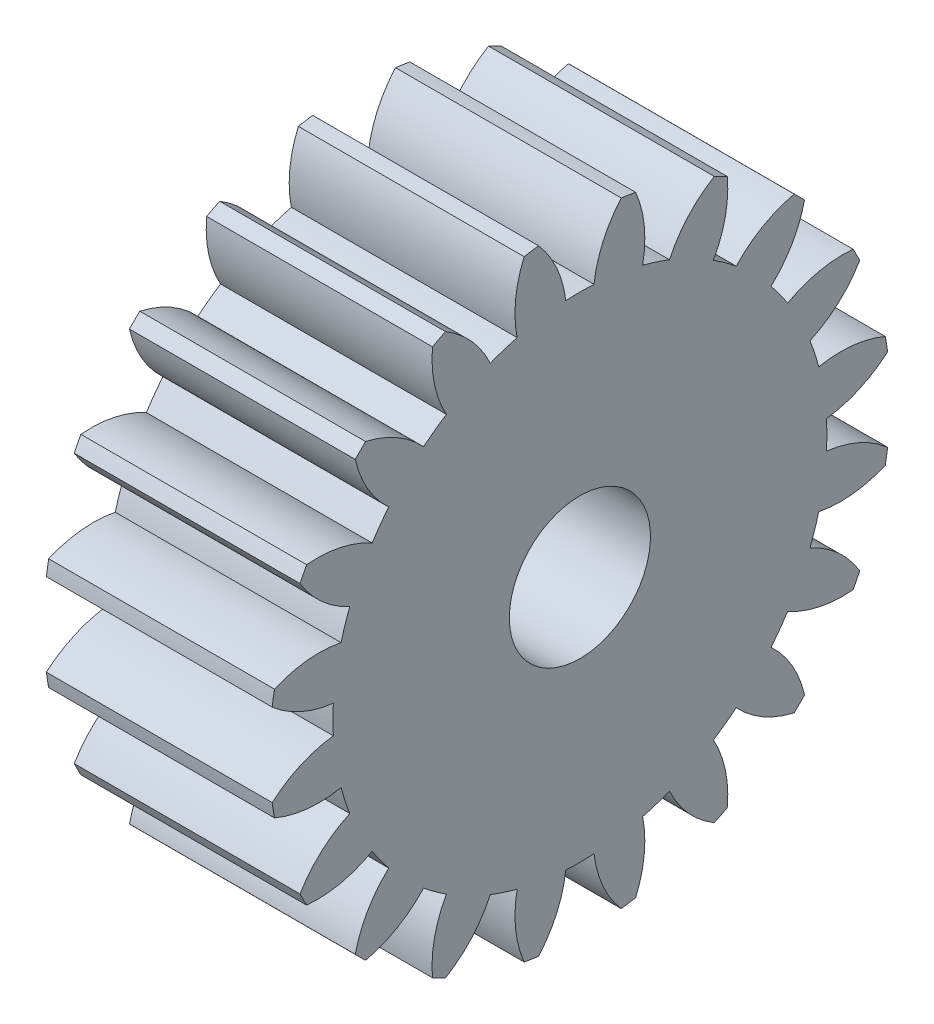
from build123d import *

# Parameters (mm, degrees)
BASPROSKE_W     = 8
BASPROSKE_H     = 11
TOOTHCUT_DEPTH  = 18.492855685
TEETHCUTS_COUNT = 20
TEETHCUTS_ANGLE = 342
BORSKE_R        = 2.5
BORE_DEPTH      = 50.0000508


with BuildPart() as part:
    # BasProSke → Base-Revolve (revolve)
    with BuildSketch(Plane(origin=(0, 0, 0), x_dir=(1, 0, 0), z_dir=(0, 1, 0)), mode=Mode.PRIVATE) as base_revolve_sk:
        with Locations((4, 5.5)):
            Rectangle(BASPROSKE_W, BASPROSKE_H)
    revolve(base_revolve_sk.sketch.rotate(Axis((-10, 0, 0), (1, 0, 0)), 180), axis=Axis((-10, 0, 0), (1, 0, 0)))

    # TooCutSke → ToothCut (cut, through all)
    with BuildSketch(Plane(origin=(0, 0, 0), x_dir=(0, 0, -1), z_dir=(1, 0, 0))):
        with BuildLine():
            ThreePointArc((0.499924007, 8.734705318), (0, 8.749), (-0.499924007, 8.734705318))
            ThreePointArc((-0.499924007, 8.734705318), (-0.824302243, 9.905497836), (-1.485192705, 10.924909509))
            ThreePointArc((-1.485192705, 10.924909509), (0, 11.0254), (1.485192705, 10.924909509))
            ThreePointArc((1.485192705, 10.924909509), (0.824302243, 9.905497836), (0.499924007, 8.734705318))
        make_face()
    toothcut = extrude(amount=TOOTHCUT_DEPTH, mode=Mode.SUBTRACT)

    # TeethCuts: ToothCut ×20 about axis
    teethcuts_axis = Axis((-10, 0, 0), (1, 0, 0))
    for i in range(1, TEETHCUTS_COUNT):
        add(toothcut.rotate(teethcuts_axis, i * TEETHCUTS_ANGLE / (TEETHCUTS_COUNT - 1)), mode=Mode.SUBTRACT)

    # BorSke → Bore (cut, symmetric)
    with BuildSketch(Plane(origin=(0, 0, 0), x_dir=(0, 0, -1), z_dir=(1, 0, 0))):
        with Locations(Location((0, 0, 0), (0, 0, 180))):
            Circle(BORSKE_R)
    extrude(amount=BORE_DEPTH, both=True, mode=Mode.SUBTRACT)


solid = part.part
